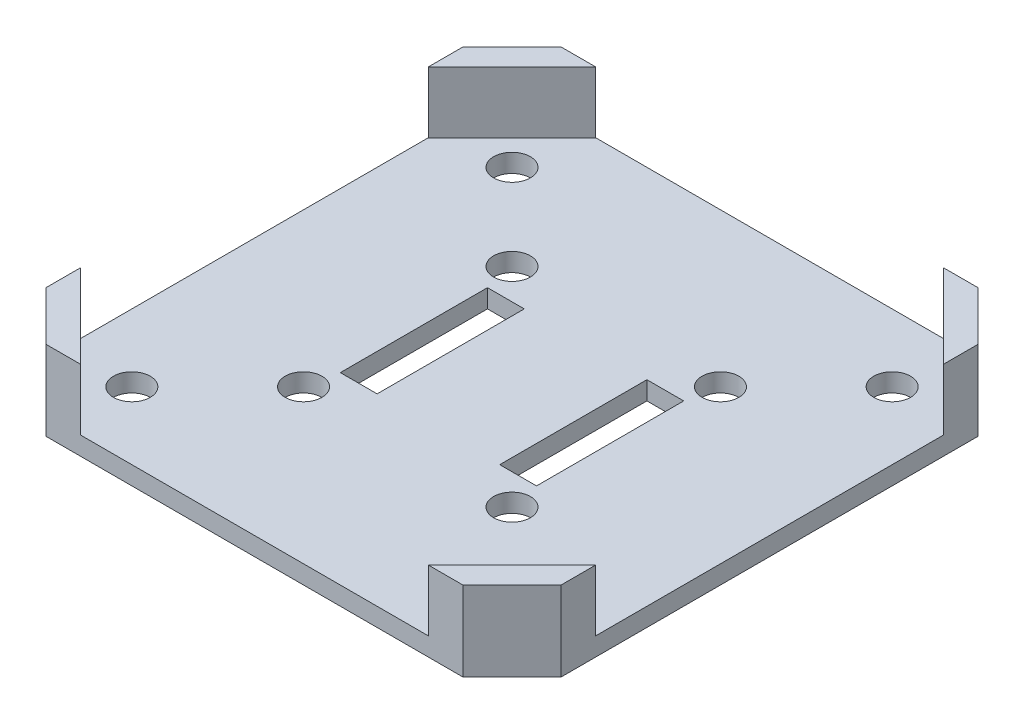
from build123d import *

# Parameters (mm, degrees)
SKETCH1_R           = 1.5
BOSS_EXTRUDE1_DEPTH = 1.5
SKETCH3_W           = 3
SKETCH3_H           = 12
CUT_EXTRUDE1_DEPTH  = 2
BOSS_EXTRUDE3_DEPTH = 5


with BuildPart() as part:
    # Sketch1 → Boss-Extrude1 (new body)
    with BuildSketch(Plane(origin=(0, 0, 0), x_dir=(1, 0, 0), z_dir=(0, 1, 0))):
        Polygon((-21, 11.5), (-21, 17), (-17, 21), (17, 21), (21, 17), (21, 11.5), (21, -11.5), (21, -17), (17, -21), (-17, -21), (-21, -17), (-21, -11.5), align=None)
        with Locations(Location((-15.5, 15.5, 0), (0, 0, 270))):
            Circle(SKETCH1_R, mode=Mode.SUBTRACT)
        with Locations(Location((15.5, 15.5, 0), (0, 0, 270))):
            Circle(SKETCH1_R, mode=Mode.SUBTRACT)
        with Locations(Location((15.5, -15.5, 0), (0, 0, 90))):
            Circle(SKETCH1_R, mode=Mode.SUBTRACT)
        with Locations(Location((-15.5, -15.5, 0), (0, 0, 90))):
            Circle(SKETCH1_R, mode=Mode.SUBTRACT)
        with Locations(Location((-8.5, 8.5, 0), (0, 0, 270))):
            Circle(SKETCH1_R, mode=Mode.SUBTRACT)
        with Locations(Location((8.5, 8.5, 0), (0, 0, 270))):
            Circle(SKETCH1_R, mode=Mode.SUBTRACT)
        with Locations(Location((8.5, -8.5, 0), (0, 0, 90))):
            Circle(SKETCH1_R, mode=Mode.SUBTRACT)
        with Locations(Location((-8.5, -8.5, 0), (0, 0, 90))):
            Circle(SKETCH1_R, mode=Mode.SUBTRACT)
    extrude(amount=BOSS_EXTRUDE1_DEPTH)

    # Sketch3 → Cut-Extrude1 (cut)
    with BuildSketch(Plane.XZ):
        with Locations((6.5, 0)):
            Rectangle(SKETCH3_W, SKETCH3_H)
        with Locations((-6.5, 0)):
            Rectangle(SKETCH3_W, SKETCH3_H)
    extrude(amount=-CUT_EXTRUDE1_DEPTH, mode=Mode.SUBTRACT)

    # Sketch2 → Boss-Extrude3 (add)
    with BuildSketch(Plane(origin=(0, 1.5, 0), x_dir=(1, 0, 0), z_dir=(0, 1, 0))):
        Polygon((17, 21), (14.171572875, 21), (15.585786438, 19.585786438), (19.585786438, 15.585786438), (21, 14.171572875), (21, 17), align=None)
        Polygon((-17, 21), (-21, 17), (-21, 14.171572875), (-19.585786438, 15.585786438), (-15.585786438, 19.585786438), (-14.171572875, 21), align=None)
        Polygon((-19.585786438, -15.585786438), (-21, -14.171572875), (-21, -17), (-17, -21), (-14.171572875, -21), (-15.585786438, -19.585786438), align=None)
        Polygon((21, -14.171572875), (14.171572875, -21), (17, -21), (21, -17), align=None)
    extrude(amount=BOSS_EXTRUDE3_DEPTH)


solid = part.part
